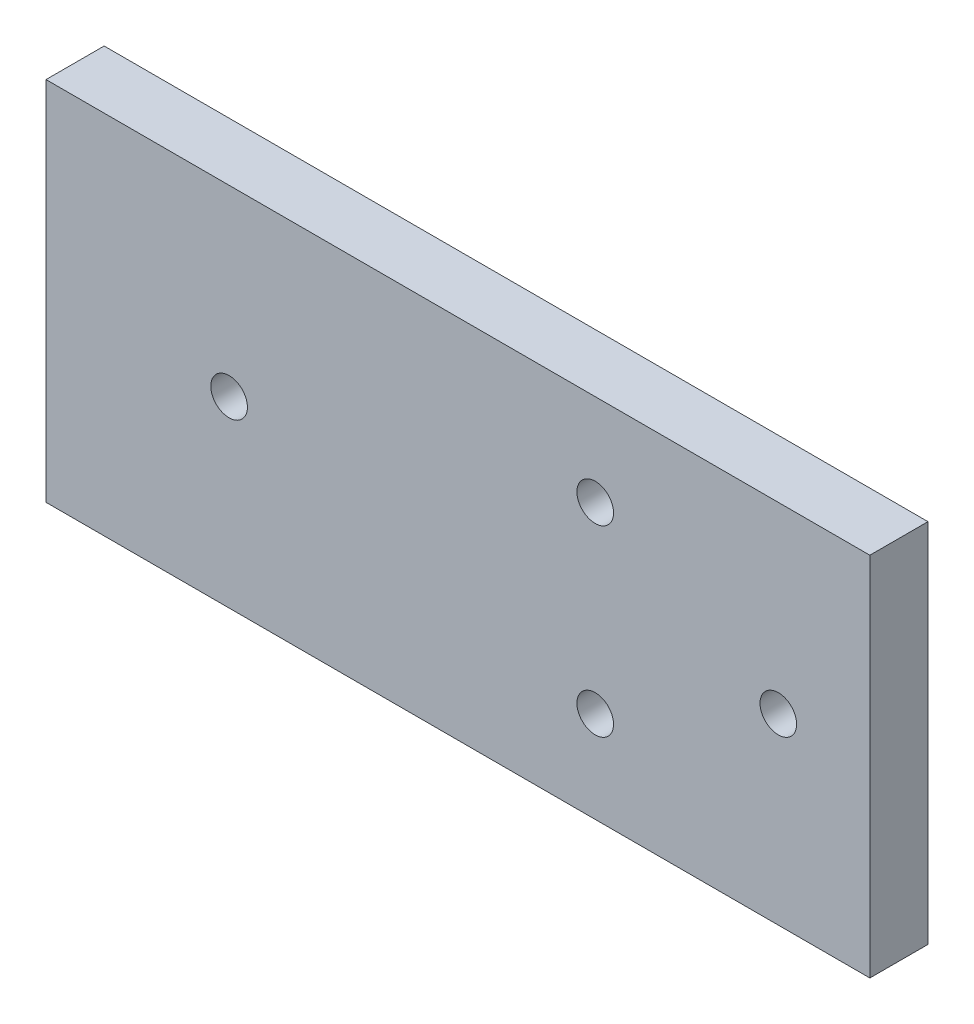
from build123d import *

# Parameters (mm, degrees)
SKETCH1_W           = 90
SKETCH1_H           = 40
SKETCH1_R           = 2
BOSS_EXTRUDE1_DEPTH = 6.35


with BuildPart() as part:
    # Sketch1 → Boss-Extrude1 (new body)
    with BuildSketch(Plane.XY):
        with Locations((45, 20)):
            Rectangle(SKETCH1_W, SKETCH1_H)
        with Locations((60, 30)):
            Circle(SKETCH1_R, mode=Mode.SUBTRACT)
        with Locations((60, 10)):
            Circle(SKETCH1_R, mode=Mode.SUBTRACT)
        with Locations((80, 20)):
            Circle(SKETCH1_R, mode=Mode.SUBTRACT)
        with Locations((20, 20)):
            Circle(SKETCH1_R, mode=Mode.SUBTRACT)
    extrude(amount=BOSS_EXTRUDE1_DEPTH)


solid = part.part
